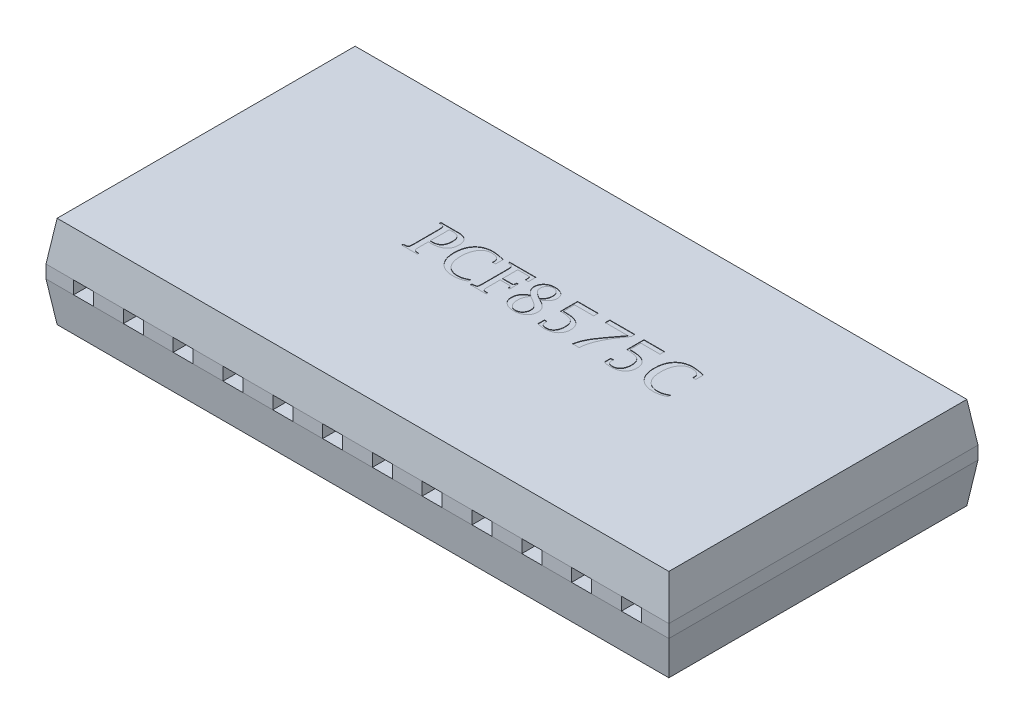
from build123d import *

# Parameters (mm, degrees)
SKETCH1_W           = 15.6
SKETCH1_H           = 7.6
BOSS_EXTRUDE1_DEPTH = 1.01
BOSS_EXTRUDE1_DRAFT = -8
SKETCH2_W           = 15.883892486
SKETCH2_H           = 7.883892486
BOSS_EXTRUDE2_DEPTH = 0.33
SKETCH3_W           = 15.883892486
SKETCH3_H           = 7.883892486
BOSS_EXTRUDE3_DEPTH = 1.01
BOSS_EXTRUDE3_TAPER = 8
SKETCH4_W           = 0.51
SKETCH4_H           = 0.33
CUT_EXTRUDE1_DEPTH  = 9.01
CUT_EXTRUDE2_DEPTH  = 0.01


with BuildPart() as part:
    # Sketch1 → Boss-Extrude1 (with draft: the straight prism first)
    with BuildSketch(Plane(origin=(0, 0, 0), x_dir=(1, 0, 0), z_dir=(0, 1, 0))):
        Rectangle(SKETCH1_W, SKETCH1_H)
    extrude(amount=BOSS_EXTRUDE1_DEPTH)
    # Boss-Extrude1: the draft: its side faces are tilted about the plane it starts from
    boss_extrude1_sides = [part.faces().sort_by_distance(p)[0] for p in [
        (-7.8, 0.505, 0),
        (0, 0.505, 3.8),
        (7.8, 0.505, 0),
        (0, 0.505, -3.8),
    ]]
    draft(boss_extrude1_sides, Plane(origin=(0, 0, 0), x_dir=(1, 0, 0), z_dir=(0, 1, 0)), BOSS_EXTRUDE1_DRAFT)

    # Sketch2 → Boss-Extrude2 (add)
    with BuildSketch(Plane(origin=(0, 1.01, 0), x_dir=(1, 0, 0), z_dir=(0, 1, 0))):
        Rectangle(SKETCH2_W, SKETCH2_H)
    extrude(amount=BOSS_EXTRUDE2_DEPTH)

    # Sketch3 → Boss-Extrude3 (add)
    with BuildSketch(Plane(origin=(0, 1.34, 0), x_dir=(1, 0, 0), z_dir=(0, 1, 0))):
        Rectangle(SKETCH3_W, SKETCH3_H)
    extrude(amount=BOSS_EXTRUDE3_DEPTH, taper=BOSS_EXTRUDE3_TAPER)

    # Sketch4 → Cut-Extrude1 (cut)
    with BuildSketch(Plane.XY.offset(3.941946243)):
        with Locations((6.986946243, 1.175)):
            Rectangle(SKETCH4_W, SKETCH4_H)
        with Locations((5.716946243, 1.175)):
            Rectangle(SKETCH4_W, SKETCH4_H)
        with Locations((4.446946243, 1.175)):
            Rectangle(SKETCH4_W, SKETCH4_H)
        with Locations((3.176946243, 1.175)):
            Rectangle(SKETCH4_W, SKETCH4_H)
        with Locations((1.906946243, 1.175)):
            Rectangle(SKETCH4_W, SKETCH4_H)
        with Locations((0.636946243, 1.175)):
            Rectangle(SKETCH4_W, SKETCH4_H)
        with Locations((-0.633053757, 1.175)):
            Rectangle(SKETCH4_W, SKETCH4_H)
        with Locations((-1.903053757, 1.175)):
            Rectangle(SKETCH4_W, SKETCH4_H)
        with Locations((-3.173053757, 1.175)):
            Rectangle(SKETCH4_W, SKETCH4_H)
        with Locations((-4.443053757, 1.175)):
            Rectangle(SKETCH4_W, SKETCH4_H)
        with Locations((-5.713053757, 1.175)):
            Rectangle(SKETCH4_W, SKETCH4_H)
        with Locations((-6.983053757, 1.175)):
            Rectangle(SKETCH4_W, SKETCH4_H)
    extrude(amount=-CUT_EXTRUDE1_DEPTH, mode=Mode.SUBTRACT)

    # Sketch5 → Cut-Extrude2 (cut)
    # profile 1 of 8: a face of its own
    with BuildSketch(Plane(origin=(0, 2.35, 0), x_dir=(1, 0, 0), z_dir=(0, 1, 0))):
        with BuildLine():
            Line((-2.54490648, 0.41025641), (-2.54490648, 0.179487179))
            add(Edge.make_bspline(
                [(-2.54490648, 0.179487179), (-2.544900951, 0.171940387), (-2.544890477, 0.157643208), (-2.543938519, 0.137347488), (-2.543097805, 0.119364644), (-2.541592105, 0.103696877), (-2.539264612, 0.090438534), (-2.537108211, 0.079356538), (-2.534131834, 0.070680065), (-2.530665831, 0.063801238), (-2.525525477, 0.058673223), (-2.519017387, 0.054256998), (-2.510625249, 0.050561064), (-2.500587919, 0.047147558), (-2.488703632, 0.044410722), (-2.475035718, 0.04230199), (-2.459599352, 0.040491789), (-2.448689818, 0.039686826), (-2.442943339, 0.039262821)],
                knots=[0, 0, 0, 0, 1.721747236, 3.261800149, 4.63516406, 5.829814576, 6.849268245, 7.706967564, 8.400837902, 8.939515546, 9.445987131, 10.037650411, 10.726147035, 11.530780707, 12.454671759, 13.504194985, 14.685361651, 16, 16, 16, 16], degree=3))
            Line((-2.442943339, 0.039262821), (-2.416701352, 0.038461538))
            Line((-2.416701352, 0.038461538), (-2.416701352, 0))
            Line((-2.416701352, 0), (-2.814137249, 0))
            Line((-2.814137249, 0), (-2.814137249, 0.038461538))
            Line((-2.814137249, 0.038461538), (-2.800916095, 0.039262821))
            add(Edge.make_bspline(
                [(-2.800916095, 0.039262821), (-2.794301054, 0.039751344), (-2.781721179, 0.040680373), (-2.763953948, 0.042699998), (-2.748260771, 0.044928347), (-2.734816612, 0.048085032), (-2.723303826, 0.051027352), (-2.714086347, 0.054886764), (-2.706760666, 0.058802926), (-2.701201646, 0.063709757), (-2.697474794, 0.070444981), (-2.69436981, 0.07896434), (-2.691607711, 0.089834681), (-2.689489315, 0.103107581), (-2.687985173, 0.118767426), (-2.686810164, 0.136871704), (-2.685976606, 0.157377572), (-2.685947439, 0.171874085), (-2.685932121, 0.179487179)],
                knots=[0, 0, 0, 0, 1.434223856, 2.727474356, 3.867048795, 4.858481374, 5.713375648, 6.432048766, 7.014145389, 7.504681859, 8.009876932, 8.658876013, 9.464418017, 10.430606696, 11.562838439, 12.865326848, 14.353772105, 16, 16, 16, 16], degree=3))
            Line((-2.685932121, 0.179487179), (-2.685932121, 0.820512821))
            add(Edge.make_bspline(
                [(-2.685932121, 0.820512821), (-2.685946655, 0.82819269), (-2.685974216, 0.842755975), (-2.686809812, 0.863328735), (-2.687986105, 0.881432534), (-2.689486541, 0.897093827), (-2.69161582, 0.910362461), (-2.694331766, 0.921184364), (-2.697469905, 0.929562005), (-2.701205042, 0.93612031), (-2.706838368, 0.940766112), (-2.714031218, 0.944768734), (-2.72336647, 0.948280657), (-2.734776105, 0.951410397), (-2.748316635, 0.954122253), (-2.763923129, 0.95681024), (-2.7817272, 0.95868536), (-2.794303129, 0.959636217), (-2.800916095, 0.960136218)],
                knots=[0, 0, 0, 0, 1.663492872, 3.154470594, 4.459175079, 5.59333322, 6.561165788, 7.368078355, 8.00468548, 8.498392893, 8.980088247, 9.563175259, 10.277674215, 11.13402302, 12.124082947, 13.267885073, 14.563335932, 16, 16, 16, 16], degree=3))
            Line((-2.800916095, 0.960136218), (-2.814137249, 0.961538462))
            Line((-2.814137249, 0.961538462), (-2.814137249, 1))
            Line((-2.814137249, 1), (-2.518263852, 1))
            Line((-2.518263852, 1), (-2.420106801, 1))
            Line((-2.420106801, 1), (-2.373832762, 1.001402244))
            add(Edge.make_bspline(
                [(-2.373832762, 1.001402244), (-2.362071996, 1.001244201), (-2.339304746, 1.000938252), (-2.306312443, 0.99761621), (-2.275619969, 0.992543105), (-2.247144695, 0.985280052), (-2.220833357, 0.976198514), (-2.196767546, 0.964804898), (-2.175284842, 0.950917758), (-2.155473323, 0.93568841), (-2.138767616, 0.917467507), (-2.123632556, 0.897831521), (-2.111283155, 0.875750049), (-2.101043981, 0.851772178), (-2.092960751, 0.825743478), (-2.087524066, 0.797592825), (-2.084034755, 0.767381576), (-2.083595032, 0.74653803), (-2.083368019, 0.735777244)],
                knots=[0, 0, 0, 0, 1.250430274, 2.420663812, 3.522824594, 4.556308805, 5.542341582, 6.47940938, 7.379777482, 8.259318291, 9.128446895, 10.000558968, 10.8911267, 11.810590311, 12.769761113, 13.783710632, 14.85580808, 16, 16, 16, 16], degree=3))
            add(Edge.make_bspline(
                [(-2.083368019, 0.735777244), (-2.083639536, 0.722672133), (-2.084168076, 0.697161556), (-2.089301106, 0.660193782), (-2.097447411, 0.625667744), (-2.108860932, 0.593648389), (-2.123497107, 0.56407649), (-2.141768934, 0.537255516), (-2.163103373, 0.512765398), (-2.187975585, 0.491058014), (-2.216095568, 0.471982805), (-2.247350022, 0.455255198), (-2.281972856, 0.441313761), (-2.319885614, 0.429965526), (-2.360999989, 0.420986641), (-2.405455308, 0.414685974), (-2.453158159, 0.41084796), (-2.486071476, 0.410457636), (-2.503039493, 0.41025641)],
                knots=[0, 0, 0, 0, 1.036758872, 2.01816814, 2.947549626, 3.840261096, 4.70297757, 5.55172306, 6.401915408, 7.267024549, 8.156852657, 9.086113912, 10.067565873, 11.105845897, 12.215105469, 13.395312345, 14.657188413, 16, 16, 16, 16], degree=3))
            Line((-2.503039493, 0.41025641), (-2.54490648, 0.41025641))
        make_face()
        with BuildLine():
            Line((-2.54490648, 0.461538462), (-2.49803148, 0.461538462))
            add(Edge.make_bspline(
                [(-2.49803148, 0.461538462), (-2.48800698, 0.461706665), (-2.468504241, 0.462033906), (-2.440208019, 0.465253864), (-2.413873378, 0.470661334), (-2.389443157, 0.47797989), (-2.367093511, 0.487657577), (-2.346610678, 0.499344161), (-2.328058239, 0.513221371), (-2.311480645, 0.529377591), (-2.297057037, 0.547805026), (-2.284347395, 0.568113086), (-2.273680581, 0.590654587), (-2.26496772, 0.615230481), (-2.258097921, 0.641972941), (-2.253414751, 0.670801629), (-2.250618861, 0.701734155), (-2.250233218, 0.723017467), (-2.250034685, 0.733974359)],
                knots=[0, 0, 0, 0, 1.138636481, 2.215225831, 3.229973037, 4.189922479, 5.107410983, 5.991024994, 6.863495058, 7.732627188, 8.61297821, 9.516081906, 10.449276379, 11.440349826, 12.474480807, 13.582034521, 14.755203701, 16, 16, 16, 16], degree=3))
            add(Edge.make_bspline(
                [(-2.250034685, 0.733974359), (-2.250189841, 0.743261054), (-2.250489454, 0.761194035), (-2.252736822, 0.787080718), (-2.256167271, 0.810959126), (-2.261436006, 0.832717759), (-2.267945801, 0.852510861), (-2.276139391, 0.870201952), (-2.285828242, 0.885811216), (-2.296966164, 0.89953604), (-2.310002583, 0.911255272), (-2.324895052, 0.921404665), (-2.341703176, 0.929993981), (-2.360658168, 0.936776768), (-2.381464713, 0.942066604), (-2.404208828, 0.946165789), (-2.428949498, 0.948223769), (-2.446078577, 0.948549176), (-2.45496257, 0.948717949)],
                knots=[0, 0, 0, 0, 1.289907877, 2.49086379, 3.607272963, 4.637710631, 5.596921144, 6.497464913, 7.339137542, 8.143218434, 8.944404818, 9.765166916, 10.640515651, 11.55903423, 12.555726557, 13.620214006, 14.76572449, 16, 16, 16, 16], degree=3))
            Line((-2.45496257, 0.948717949), (-2.54490648, 0.948717949))
            Line((-2.54490648, 0.948717949), (-2.54490648, 0.461538462))
        make_face(mode=Mode.SUBTRACT)
    # profile 2 of 8: a face of its own
    with BuildSketch(Plane(origin=(0, 2.35, 0), x_dir=(1, 0, 0), z_dir=(0, 1, 0))):
        with BuildLine():
            add(Edge.make_bspline(
                [(-1.173111608, 0.051282051), (-1.184509921, 0.045098096), (-1.207373049, 0.032694106), (-1.243402108, 0.017173883), (-1.280680954, 0.003943184), (-1.319354745, -0.00693572), (-1.359450844, -0.015311751), (-1.400933371, -0.021259529), (-1.443809865, -0.024983853), (-1.472850162, -0.025419523), (-1.487614813, -0.025641026)],
                knots=[0, 0, 0, 0, 0.950097763, 1.905738653, 2.871688724, 3.847851376, 4.848060568, 5.871763302, 6.917963107, 8, 8, 8, 8], degree=3))
            add(Edge.make_bspline(
                [(-1.487614813, -0.025641026), (-1.506198699, -0.025238229), (-1.542554025, -0.024450246), (-1.595526174, -0.017708574), (-1.645576891, -0.006852396), (-1.69244231, 0.00892245), (-1.736405735, 0.028697223), (-1.777263469, 0.053189732), (-1.814978366, 0.08214106), (-1.849578619, 0.11527164), (-1.880291557, 0.152365401), (-1.907380411, 0.192710832), (-1.930315496, 0.236323482), (-1.948680725, 0.283355308), (-1.963104199, 0.333456528), (-1.973470906, 0.386801551), (-1.979759418, 0.443358059), (-1.980450409, 0.482154941), (-1.980803916, 0.502003205)],
                knots=[0, 0, 0, 0, 1.0907127, 2.133741934, 3.129613494, 4.092881734, 5.031519219, 5.954636873, 6.883025615, 7.817429068, 8.761096259, 9.704885592, 10.665853524, 11.647925027, 12.664084858, 13.722792364, 14.834993506, 16, 16, 16, 16], degree=3))
            add(Edge.make_bspline(
                [(-1.980803916, 0.502003205), (-1.980422377, 0.52211633), (-1.979679177, 0.561294784), (-1.973826818, 0.618364305), (-1.964132826, 0.672061986), (-1.950319182, 0.722279089), (-1.932725721, 0.769118891), (-1.910968131, 0.812382871), (-1.885515625, 0.852353742), (-1.855918263, 0.888508967), (-1.822819698, 0.920865809), (-1.786397791, 0.949048665), (-1.746823562, 0.972897503), (-1.704007217, 0.992146637), (-1.658064671, 1.007178089), (-1.609017783, 1.017927694), (-1.556832148, 1.024409578), (-1.521020545, 1.025223334), (-1.502638852, 1.025641026)],
                knots=[0, 0, 0, 0, 1.198437993, 2.334443252, 3.414667221, 4.446694533, 5.434080735, 6.391511889, 7.327567475, 8.252356355, 9.169726966, 10.0802973, 10.990685018, 11.916765772, 12.871878647, 13.866328085, 14.904810219, 16, 16, 16, 16], degree=3))
            add(Edge.make_bspline(
                [(-1.502638852, 1.025641026), (-1.492618707, 1.025472835), (-1.471751015, 1.025122564), (-1.439403538, 1.022578278), (-1.404797453, 1.018527853), (-1.367926574, 1.012859747), (-1.328776313, 1.005665418), (-1.287385014, 0.996744997), (-1.243756636, 0.986379002), (-1.214025227, 0.9784381), (-1.198752634, 0.974358974)],
                knots=[0, 0, 0, 0, 0.778211485, 1.620683054, 2.518725369, 3.483977919, 4.517483666, 5.609946115, 6.772264103, 8, 8, 8, 8], degree=3))
            Line((-1.198752634, 0.974358974), (-1.198752634, 0.782051282))
            Line((-1.198752634, 0.782051282), (-1.275675711, 0.782051282))
            Line((-1.275675711, 0.782051282), (-1.275675711, 0.795272436))
            add(Edge.make_bspline(
                [(-1.275675711, 0.795272436), (-1.275675711, 0.801883013), (-1.275675711, 0.81497062), (-1.275675711, 0.828058226), (-1.275675711, 0.834535256)],
                knots=[0, 0, 0, 0, 1.010204082, 2, 2, 2, 2], degree=3))
            add(Edge.make_bspline(
                [(-1.275675711, 0.834535256), (-1.275892618, 0.839819871), (-1.276315403, 0.8501204), (-1.278920584, 0.865242625), (-1.283562194, 0.879439985), (-1.289950909, 0.89289286), (-1.29865828, 0.905104176), (-1.308590051, 0.916925638), (-1.320834953, 0.927477816), (-1.33463801, 0.937293277), (-1.350031871, 0.946025582), (-1.366778237, 0.953688724), (-1.384884572, 0.960096883), (-1.404409059, 0.965201666), (-1.425180014, 0.969514184), (-1.447366474, 0.972133019), (-1.470754201, 0.974054497), (-1.486809151, 0.974255893), (-1.495026672, 0.974358974)],
                knots=[0, 0, 0, 0, 0.872940392, 1.70149544, 2.524527953, 3.333401312, 4.150129811, 4.994603991, 5.877449129, 6.810717511, 7.788717292, 8.795394151, 9.848766788, 10.956224994, 12.126265042, 13.349109787, 14.643175601, 16, 16, 16, 16], degree=3))
            add(Edge.make_bspline(
                [(-1.495026672, 0.974358974), (-1.506871308, 0.973987283), (-1.530117969, 0.973257789), (-1.564080933, 0.967115426), (-1.59615142, 0.956891596), (-1.626337121, 0.942424473), (-1.654747409, 0.924137373), (-1.68114723, 0.90159105), (-1.7057418, 0.875108789), (-1.728157597, 0.844722147), (-1.748360259, 0.81102497), (-1.765999514, 0.774396177), (-1.780962642, 0.735119269), (-1.793270939, 0.693132992), (-1.802503901, 0.648424027), (-1.809339502, 0.601002708), (-1.813318365, 0.550882863), (-1.813859969, 0.516566879), (-1.814137249, 0.498998397)],
                knots=[0, 0, 0, 0, 0.888373946, 1.743551007, 2.580294788, 3.407379563, 4.248314273, 5.108731313, 6.00576896, 6.954874221, 7.937159125, 8.950188932, 10.001809612, 11.088010484, 12.230028994, 13.42485153, 14.681621673, 16, 16, 16, 16], degree=3))
            add(Edge.make_bspline(
                [(-1.814137249, 0.498998397), (-1.813850772, 0.481358154), (-1.813294045, 0.447076995), (-1.808375291, 0.397140125), (-1.800515794, 0.350164848), (-1.789242339, 0.306171471), (-1.775187468, 0.26499547), (-1.757338361, 0.227011205), (-1.736850735, 0.191663436), (-1.712674566, 0.159804391), (-1.685779818, 0.131217174), (-1.656284675, 0.106226421), (-1.624150075, 0.085242609), (-1.589557074, 0.068144529), (-1.55252143, 0.054560843), (-1.512807263, 0.045410166), (-1.470776582, 0.03931042), (-1.441897636, 0.038748908), (-1.427118019, 0.038461538)],
                knots=[0, 0, 0, 0, 1.242005494, 2.413650741, 3.529974997, 4.592937592, 5.608668543, 6.589038791, 7.54391707, 8.480640935, 9.398755183, 10.303097998, 11.196518338, 12.094493543, 13.015313349, 13.967687329, 14.959906499, 16, 16, 16, 16], degree=3))
            add(Edge.make_bspline(
                [(-1.427118019, 0.038461538), (-1.417091489, 0.038696789), (-1.396841925, 0.039171901), (-1.366243226, 0.042972032), (-1.335125636, 0.049003546), (-1.303525077, 0.057410627), (-1.271510939, 0.068357308), (-1.239034199, 0.081656054), (-1.205947439, 0.09721001), (-1.184197131, 0.109248788), (-1.173111608, 0.115384615)],
                knots=[0, 0, 0, 0, 0.896500142, 1.810570349, 2.753391962, 3.729718686, 4.732516545, 5.777170997, 6.867086282, 8, 8, 8, 8], degree=3))
            Line((-1.173111608, 0.115384615), (-1.173111608, 0.051282051))
        make_face()
    # profile 3 of 8: a face of its own
    with BuildSketch(Plane(origin=(0, 2.35, 0), x_dir=(1, 0, 0), z_dir=(0, 1, 0))):
        with BuildLine():
            Line((-0.788496224, 0.487179487), (-0.788496224, 0.179487179))
            add(Edge.make_bspline(
                [(-0.788496224, 0.179487179), (-0.788462087, 0.172742471), (-0.788396842, 0.159851105), (-0.787791743, 0.141416441), (-0.786849979, 0.12484288), (-0.785407913, 0.110083983), (-0.78380359, 0.09712979), (-0.781247442, 0.086015797), (-0.778834259, 0.076629452), (-0.774948701, 0.066688305), (-0.767596261, 0.056477983), (-0.754495636, 0.04839419), (-0.7381824, 0.043299379), (-0.726107942, 0.042889606), (-0.719585967, 0.042668269)],
                knots=[0, 0, 0, 0, 1.370981959, 2.620399742, 3.749035402, 4.744439625, 5.635128633, 6.399228633, 7.061132633, 7.603050211, 8.564082396, 9.554197555, 10.678908651, 12, 12, 12, 12], degree=3))
            add(Edge.make_bspline(
                [(-0.719585967, 0.042668269), (-0.718250371, 0.042603932), (-0.713840219, 0.042391488), (-0.704553495, 0.04177578), (-0.690016176, 0.040457376), (-0.678522678, 0.039699105), (-0.671909685, 0.039262821)],
                knots=[0, 0, 0, 0, 0.33568548, 1.108436944, 2.336286713, 4, 4, 4, 4], degree=3))
            Line((-0.671909685, 0.039262821), (-0.660291095, 0.038461538))
            Line((-0.660291095, 0.038461538), (-0.660291095, 0))
            Line((-0.660291095, 0), (-1.057726993, 0))
            Line((-1.057726993, 0), (-1.057726993, 0.038461538))
            Line((-1.057726993, 0.038461538), (-1.044505839, 0.039262821))
            add(Edge.make_bspline(
                [(-1.044505839, 0.039262821), (-1.037890797, 0.039751344), (-1.025310922, 0.040680373), (-1.007543692, 0.042699998), (-0.991850515, 0.044928347), (-0.978406355, 0.048085032), (-0.966893569, 0.051027352), (-0.957676091, 0.054886764), (-0.950350409, 0.058802926), (-0.944791389, 0.063709757), (-0.941064538, 0.070444981), (-0.937959553, 0.07896434), (-0.935197454, 0.089834681), (-0.933079059, 0.103107581), (-0.931574917, 0.118767426), (-0.930399907, 0.136871704), (-0.929566349, 0.157377572), (-0.929537182, 0.171874085), (-0.929521865, 0.179487179)],
                knots=[0, 0, 0, 0, 1.434223856, 2.727474356, 3.867048795, 4.858481374, 5.713375648, 6.432048766, 7.014145389, 7.504681859, 8.009876932, 8.658876013, 9.464418017, 10.430606696, 11.562838439, 12.865326848, 14.353772105, 16, 16, 16, 16], degree=3))
            Line((-0.929521865, 0.179487179), (-0.929521865, 0.820512821))
            add(Edge.make_bspline(
                [(-0.929521865, 0.820512821), (-0.929536399, 0.82819269), (-0.929563959, 0.842755975), (-0.930399555, 0.863328735), (-0.931575848, 0.881432534), (-0.933076284, 0.897093827), (-0.935205564, 0.910362461), (-0.93792151, 0.921184364), (-0.941059649, 0.929562005), (-0.944794785, 0.93612031), (-0.950428112, 0.940766112), (-0.957620961, 0.944768734), (-0.966956214, 0.948280657), (-0.978365848, 0.951410397), (-0.991906379, 0.954122253), (-1.007512873, 0.95681024), (-1.025316944, 0.95868536), (-1.037892873, 0.959636217), (-1.044505839, 0.960136218)],
                knots=[0, 0, 0, 0, 1.663492872, 3.154470594, 4.459175079, 5.59333322, 6.561165788, 7.368078355, 8.00468548, 8.498392893, 8.980088247, 9.563175259, 10.277674215, 11.13402302, 12.124082947, 13.267885073, 14.563335932, 16, 16, 16, 16], degree=3))
            Line((-1.044505839, 0.960136218), (-1.057726993, 0.961538462))
            Line((-1.057726993, 0.961538462), (-1.057726993, 1))
            Line((-1.057726993, 1), (-0.391060326, 1))
            Line((-0.391060326, 1), (-0.391060326, 0.807692308))
            Line((-0.391060326, 0.807692308), (-0.467983403, 0.807692308))
            Line((-0.467983403, 0.807692308), (-0.468784685, 0.821314103))
            add(Edge.make_bspline(
                [(-0.468784685, 0.821314103), (-0.469229161, 0.82906088), (-0.470064957, 0.843627993), (-0.471580918, 0.864076232), (-0.473567972, 0.881668569), (-0.474862641, 0.896504124), (-0.476993032, 0.908343204), (-0.47880854, 0.917494876), (-0.480918405, 0.923682374), (-0.483287942, 0.928337037), (-0.488322412, 0.930006284), (-0.494861411, 0.931944582), (-0.504663935, 0.932726501), (-0.517222918, 0.934157922), (-0.532826582, 0.934666921), (-0.551303237, 0.935728135), (-0.572753357, 0.935643977), (-0.588042997, 0.935809339), (-0.596188531, 0.935897436)],
                knots=[0, 0, 0, 0, 1.680288217, 3.15962939, 4.438653293, 5.514849284, 6.380093388, 7.046617638, 7.522226697, 7.814997939, 8.118979767, 8.613551646, 9.312981904, 10.228016992, 11.35729639, 12.688775674, 14.235949932, 16, 16, 16, 16], degree=3))
            Line((-0.596188531, 0.935897436), (-0.788496224, 0.935897436))
            Line((-0.788496224, 0.935897436), (-0.788496224, 0.551282051))
            Line((-0.788496224, 0.551282051), (-0.609009044, 0.551282051))
            add(Edge.make_bspline(
                [(-0.609009044, 0.551282051), (-0.603599751, 0.551238817), (-0.593380343, 0.551157137), (-0.578894547, 0.551697922), (-0.566067378, 0.551999488), (-0.554847574, 0.552615423), (-0.545283159, 0.553330805), (-0.537418515, 0.55441943), (-0.531145362, 0.555266514), (-0.526188482, 0.556624147), (-0.522086613, 0.559038143), (-0.518944267, 0.563087088), (-0.516199988, 0.568423345), (-0.513555043, 0.575113032), (-0.51143836, 0.58339192), (-0.50968081, 0.593169955), (-0.508332418, 0.60448188), (-0.507623642, 0.612511268), (-0.507246224, 0.616786859)],
                knots=[0, 0, 0, 0, 1.751385194, 3.30877253, 4.693258577, 5.905829026, 6.947284358, 7.797445791, 8.476391601, 8.996220685, 9.452338107, 9.989418424, 10.627909597, 11.394806486, 12.312661423, 13.389864397, 14.610121581, 16, 16, 16, 16], degree=3))
            Line((-0.507246224, 0.616786859), (-0.506444942, 0.628205128))
            Line((-0.506444942, 0.628205128), (-0.467983403, 0.628205128))
            Line((-0.467983403, 0.628205128), (-0.467983403, 0.41025641))
            Line((-0.467983403, 0.41025641), (-0.506444942, 0.41025641))
            Line((-0.506444942, 0.41025641), (-0.507246224, 0.422075321))
            add(Edge.make_bspline(
                [(-0.507246224, 0.422075321), (-0.507943993, 0.429179234), (-0.509193239, 0.44189766), (-0.513045863, 0.458539108), (-0.518068405, 0.470796333), (-0.524562919, 0.477744815), (-0.531066661, 0.480663956), (-0.537344254, 0.482412522), (-0.545293649, 0.483666748), (-0.554816064, 0.485166422), (-0.566059411, 0.486091295), (-0.578889725, 0.486627349), (-0.593381693, 0.487040704), (-0.603600092, 0.487131451), (-0.609009044, 0.487179487)],
                knots=[0, 0, 0, 0, 1.773766812, 3.175646797, 4.238246652, 5.036871456, 5.460324792, 5.996470383, 6.654580711, 7.460255629, 8.394071235, 9.458227633, 10.654551766, 12, 12, 12, 12], degree=3))
            Line((-0.609009044, 0.487179487), (-0.788496224, 0.487179487))
        make_face()
    # profile 4 of 8: a face of its own
    with BuildSketch(Plane(origin=(0, 2.35, 0), x_dir=(1, 0, 0), z_dir=(0, 1, 0))):
        with BuildLine():
            add(Edge.make_bspline(
                [(-0.059329557, 0.538461538), (-0.071372182, 0.547208681), (-0.094555779, 0.564048053), (-0.125614325, 0.591673151), (-0.151967745, 0.619868166), (-0.173790732, 0.648664925), (-0.19058471, 0.678245675), (-0.202577203, 0.708499813), (-0.210192077, 0.739408625), (-0.211113493, 0.760374415), (-0.211573147, 0.770833333)],
                knots=[0, 0, 0, 0, 1.235470982, 2.378440043, 3.445684424, 4.436056507, 5.372159975, 6.260810668, 7.132394353, 8, 8, 8, 8], degree=3))
            add(Edge.make_bspline(
                [(-0.211573147, 0.770833333), (-0.211364395, 0.780061378), (-0.210954099, 0.798198801), (-0.207068047, 0.824728963), (-0.200659675, 0.849902172), (-0.19174389, 0.873716032), (-0.180586181, 0.89637718), (-0.166381523, 0.917416261), (-0.149876539, 0.937165497), (-0.130971775, 0.9553791), (-0.110158352, 0.971903379), (-0.087456543, 0.98619732), (-0.063349278, 0.998475243), (-0.037610408, 1.008573984), (-0.010231374, 1.016010426), (0.018525334, 1.021764848), (0.048842691, 1.024864264), (0.06953707, 1.025378637), (0.08009352, 1.025641026)],
                knots=[0, 0, 0, 0, 1.017603329, 2.000066475, 2.950634958, 3.878406239, 4.800897718, 5.730568226, 6.671928419, 7.635764454, 8.621784215, 9.598707632, 10.590407862, 11.602771015, 12.643054995, 13.716537606, 14.835178607, 16, 16, 16, 16], degree=3))
            add(Edge.make_bspline(
                [(0.08009352, 1.025641026), (0.090183354, 1.025445024), (0.109868885, 1.025062619), (0.138582443, 1.022196766), (0.165798551, 1.017676993), (0.191400197, 1.011094677), (0.215447815, 1.002611707), (0.238034812, 0.992403327), (0.259068302, 0.980221079), (0.278343264, 0.966120852), (0.295753522, 0.950635963), (0.310877747, 0.933653128), (0.323837203, 0.915585444), (0.334328517, 0.896109282), (0.34258743, 0.875420742), (0.348382146, 0.853425676), (0.351832953, 0.830170812), (0.352293465, 0.814248071), (0.352529417, 0.806089744)],
                knots=[0, 0, 0, 0, 1.230491035, 2.400720398, 3.516068681, 4.592651107, 5.620438456, 6.622739508, 7.611749461, 8.579401848, 9.531052595, 10.448202443, 11.347642563, 12.23684711, 13.139746769, 14.058378078, 15.005172094, 16, 16, 16, 16], degree=3))
            add(Edge.make_bspline(
                [(0.352529417, 0.806089744), (0.352364012, 0.799739845), (0.352037428, 0.787202253), (0.349770933, 0.768568655), (0.346035267, 0.750381294), (0.34047476, 0.732616596), (0.33373169, 0.715241498), (0.325447466, 0.698166474), (0.315397484, 0.681746471), (0.304091784, 0.665447185), (0.291102667, 0.649760128), (0.276580807, 0.634506762), (0.260635835, 0.619541739), (0.243112961, 0.605112765), (0.224139653, 0.590883149), (0.203436201, 0.57745613), (0.181531992, 0.56390669), (0.166079314, 0.555671581), (0.15821852, 0.551482372)],
                knots=[0, 0, 0, 0, 0.902053673, 1.781064641, 2.662988873, 3.536247224, 4.42239645, 5.309154853, 6.228405224, 7.154823824, 8.125366216, 9.118549546, 10.145459491, 11.230164823, 12.342035522, 13.512927594, 14.734823609, 16, 16, 16, 16], degree=3))
            add(Edge.make_bspline(
                [(0.15821852, 0.551482372), (0.168147522, 0.547243701), (0.187608667, 0.53893578), (0.215410274, 0.525010754), (0.241439274, 0.510734759), (0.265542835, 0.495579236), (0.287587647, 0.47968098), (0.307858256, 0.463156708), (0.326126298, 0.445879236), (0.342610231, 0.427975745), (0.356881187, 0.409068194), (0.369619766, 0.389806607), (0.379998903, 0.369574838), (0.388757622, 0.348781479), (0.395509203, 0.327248885), (0.400379782, 0.305000656), (0.403199882, 0.282057492), (0.40360572, 0.266500683), (0.403811469, 0.258613782)],
                knots=[0, 0, 0, 0, 1.270931196, 2.491063488, 3.659484921, 4.765445501, 5.841229715, 6.858018447, 7.842464959, 8.799754576, 9.719700648, 10.629103352, 11.515301602, 12.392877746, 13.283112732, 14.168333839, 15.071392509, 16, 16, 16, 16], degree=3))
            add(Edge.make_bspline(
                [(0.403811469, 0.258613782), (0.403596402, 0.248376427), (0.403175181, 0.228325973), (0.39825551, 0.199018804), (0.391022749, 0.171075707), (0.380464994, 0.144600031), (0.366967728, 0.119580984), (0.35037915, 0.096089633), (0.331021992, 0.073820176), (0.308651858, 0.053433578), (0.284095138, 0.034882881), (0.257753632, 0.018481942), (0.229544646, 0.004938281), (0.199765083, -0.006418609), (0.168194725, -0.014926358), (0.134975178, -0.021110888), (0.100086154, -0.025037523), (0.076231265, -0.025437222), (0.064067879, -0.025641026)],
                knots=[0, 0, 0, 0, 0.989470554, 1.937935584, 2.867196409, 3.777741942, 4.688287476, 5.611306817, 6.554520819, 7.537537799, 8.533734375, 9.52875718, 10.5342531, 11.55654412, 12.608176456, 13.692787712, 14.823573918, 16, 16, 16, 16], degree=3))
            add(Edge.make_bspline(
                [(0.064067879, -0.025641026), (0.052174709, -0.025401061), (0.028939167, -0.024932244), (-0.005029105, -0.021544681), (-0.037222299, -0.015683802), (-0.067768155, -0.00778341), (-0.096601528, 0.002698735), (-0.123687803, 0.015528107), (-0.149050203, 0.030605987), (-0.172514673, 0.047796773), (-0.193637559, 0.066944441), (-0.212335358, 0.087601522), (-0.227739147, 0.11009923), (-0.240776161, 0.133755894), (-0.250508378, 0.159083124), (-0.257840858, 0.185619512), (-0.262083111, 0.213739155), (-0.262593936, 0.232958654), (-0.262855198, 0.242788462)],
                knots=[0, 0, 0, 0, 1.202161924, 2.348649329, 3.446227137, 4.507140741, 5.534210673, 6.542657962, 7.532408414, 8.512537285, 9.477841653, 10.410034752, 11.321894014, 12.227989094, 13.134235011, 14.057761382, 15.006642549, 16, 16, 16, 16], degree=3))
            add(Edge.make_bspline(
                [(-0.262855198, 0.242788462), (-0.262709665, 0.251074865), (-0.262423832, 0.267349716), (-0.259913592, 0.291375287), (-0.256008706, 0.314560789), (-0.250280211, 0.336876391), (-0.243389474, 0.358469225), (-0.234476279, 0.379021129), (-0.224225278, 0.398915621), (-0.212194556, 0.417807457), (-0.198711929, 0.436046711), (-0.183467804, 0.453172272), (-0.166659254, 0.469564397), (-0.14831871, 0.485093097), (-0.128351704, 0.49978059), (-0.106856676, 0.513589538), (-0.083799645, 0.526671543), (-0.067590483, 0.534481321), (-0.059329557, 0.538461538)],
                knots=[0, 0, 0, 0, 1.041162887, 2.044888676, 3.032736595, 3.993440739, 4.938214892, 5.878168641, 6.80529738, 7.748243429, 8.68984412, 9.653000959, 10.626268621, 11.638483689, 12.670747295, 13.739218098, 14.847802764, 16, 16, 16, 16], degree=3))
        make_face()
        with BuildLine():
            add(Edge.make_bspline(
                [(0.122761789, 0.574519231), (0.131891588, 0.581861531), (0.149789682, 0.596255407), (0.173109001, 0.620958699), (0.192979867, 0.647316444), (0.209003493, 0.675597659), (0.221898503, 0.705414181), (0.230536837, 0.737195623), (0.236187497, 0.770631643), (0.236821363, 0.793579161), (0.237144802, 0.805288462)],
                knots=[0, 0, 0, 0, 1.049780005, 2.05799296, 3.037789665, 4.003482535, 4.966813998, 5.943310481, 6.950544631, 8, 8, 8, 8], degree=3))
            add(Edge.make_bspline(
                [(0.237144802, 0.805288462), (0.236955424, 0.811968149), (0.236587169, 0.824957128), (0.234746569, 0.844046378), (0.230740802, 0.861995639), (0.225971068, 0.879153615), (0.21908737, 0.895031662), (0.211456406, 0.910290663), (0.201670483, 0.924194471), (0.190895593, 0.937264623), (0.178999315, 0.949099872), (0.165778926, 0.959176515), (0.151716909, 0.96775634), (0.136807221, 0.975187269), (0.120718035, 0.980472539), (0.103798697, 0.984225112), (0.085979021, 0.986773436), (0.073759272, 0.987041561), (0.067473328, 0.987179487)],
                knots=[0, 0, 0, 0, 1.14476972, 2.226060639, 3.278220725, 4.291678839, 5.270995093, 6.237941673, 7.208804398, 8.175412636, 9.137951497, 10.075982343, 11.015685508, 11.956988524, 12.922784259, 13.907895137, 14.923803245, 16, 16, 16, 16], degree=3))
            add(Edge.make_bspline(
                [(0.067473328, 0.987179487), (0.06185882, 0.987008876), (0.050852961, 0.986674436), (0.034630283, 0.984529597), (0.01917225, 0.980407273), (0.004287201, 0.974982766), (-0.01012074, 0.968196966), (-0.023655623, 0.959503283), (-0.036634114, 0.949409818), (-0.048654887, 0.937829762), (-0.059916832, 0.925388855), (-0.069468071, 0.911843531), (-0.077878059, 0.897805335), (-0.084321573, 0.882832756), (-0.089957174, 0.867470723), (-0.093420771, 0.851216401), (-0.095716784, 0.834334265), (-0.096029249, 0.82279124), (-0.096188531, 0.816907051)],
                knots=[0, 0, 0, 0, 1.024768085, 2.008805395, 2.978247801, 3.938146401, 4.897426011, 5.877834965, 6.867514953, 7.893224488, 8.920380722, 9.924731158, 10.913285187, 11.900636779, 12.894957204, 13.894193769, 14.926541335, 16, 16, 16, 16], degree=3))
            add(Edge.make_bspline(
                [(-0.096188531, 0.816907051), (-0.096124942, 0.811153528), (-0.096000215, 0.799868313), (-0.093484172, 0.78338147), (-0.090587593, 0.767450291), (-0.085478147, 0.752353321), (-0.079763495, 0.737663076), (-0.071840453, 0.724095469), (-0.0633118, 0.710819089), (-0.052789156, 0.698225759), (-0.04023358, 0.685532048), (-0.025049922, 0.672370944), (-0.007252459, 0.658139192), (0.013486182, 0.643258501), (0.036716561, 0.627074086), (0.063022669, 0.610466525), (0.091820747, 0.592508733), (0.112177649, 0.58067298), (0.122761789, 0.574519231)],
                knots=[0, 0, 0, 0, 0.800266805, 1.56967888, 2.319277373, 3.051601154, 3.78557644, 4.510004156, 5.234789938, 5.981382626, 6.790248919, 7.719342157, 8.778128376, 9.963037497, 11.273480552, 12.72069351, 14.294994009, 16, 16, 16, 16], degree=3))
        make_face(mode=Mode.SUBTRACT)
        with BuildLine():
            add(Edge.make_bspline(
                [(-0.029882442, 0.509214744), (-0.03729441, 0.501233787), (-0.052051738, 0.485343593), (-0.070623513, 0.458541496), (-0.086613105, 0.430022731), (-0.099406436, 0.399329091), (-0.109416349, 0.366782289), (-0.116594967, 0.332250653), (-0.121117745, 0.295793524), (-0.121589013, 0.270780143), (-0.121829557, 0.258012821)],
                knots=[0, 0, 0, 0, 0.951053354, 1.893560127, 2.842048612, 3.804709726, 4.794316317, 5.814320991, 6.884386366, 8, 8, 8, 8], degree=3))
            add(Edge.make_bspline(
                [(-0.121829557, 0.258012821), (-0.121678368, 0.248793726), (-0.121384208, 0.230856718), (-0.119025669, 0.204659651), (-0.114732765, 0.180063809), (-0.109281726, 0.156804864), (-0.101727419, 0.135174041), (-0.09301659, 0.114740785), (-0.082356502, 0.095899876), (-0.070151147, 0.078637575), (-0.056526221, 0.063180042), (-0.041710945, 0.049688156), (-0.025604175, 0.038307147), (-0.008432406, 0.028884387), (0.009938395, 0.021593769), (0.029480439, 0.016681118), (0.050061967, 0.013301941), (0.064254035, 0.012982932), (0.071479738, 0.012820513)],
                knots=[0, 0, 0, 0, 1.257761483, 2.44714689, 3.583939257, 4.662241257, 5.702302805, 6.705976446, 7.689096577, 8.649670175, 9.585560186, 10.495003207, 11.377206756, 12.270071198, 13.161633273, 14.06540023, 15.015024287, 16, 16, 16, 16], degree=3))
            add(Edge.make_bspline(
                [(0.071479738, 0.012820513), (0.078231024, 0.013041006), (0.091450023, 0.013472732), (0.110878394, 0.016039694), (0.129334254, 0.020674577), (0.146925079, 0.027133674), (0.163634737, 0.035409364), (0.179609207, 0.045468684), (0.194545051, 0.057546367), (0.208626547, 0.071167749), (0.221280424, 0.086226629), (0.232400305, 0.102402669), (0.241852752, 0.119419541), (0.249477874, 0.137437316), (0.255572492, 0.15632171), (0.259662798, 0.176277203), (0.262400993, 0.197105952), (0.262656244, 0.211329063), (0.262785828, 0.218549679)],
                knots=[0, 0, 0, 0, 1.031654177, 2.019976, 2.987437171, 3.933137745, 4.877571841, 5.831381699, 6.811242613, 7.806856487, 8.820496673, 9.810922431, 10.801820957, 11.789089132, 12.79572298, 13.828183925, 14.897438894, 16, 16, 16, 16], degree=3))
            add(Edge.make_bspline(
                [(0.262785828, 0.218549679), (0.262690203, 0.224565094), (0.262502638, 0.236364089), (0.260437087, 0.253723611), (0.25703777, 0.270330459), (0.252404041, 0.286200882), (0.246689667, 0.301406412), (0.239093444, 0.315623321), (0.230536337, 0.329275835), (0.220449082, 0.342454594), (0.208408669, 0.355344688), (0.194329375, 0.368558701), (0.17797076, 0.382215131), (0.159282712, 0.396391104), (0.138338072, 0.411249145), (0.114764854, 0.426123264), (0.089147153, 0.44179632), (0.07117044, 0.452164637), (0.061864353, 0.457532051)],
                knots=[0, 0, 0, 0, 0.873537029, 1.713407783, 2.535270721, 3.333434478, 4.113472046, 4.890124437, 5.67058412, 6.452489322, 7.296885605, 8.230159982, 9.256085101, 10.391094331, 11.63719406, 12.985330298, 14.439382093, 16, 16, 16, 16], degree=3))
            Line((0.061864353, 0.457532051), (-0.029882442, 0.509214744))
        make_face(mode=Mode.SUBTRACT)
    # profile 5 of 8: a face of its own
    with BuildSketch(Plane(origin=(0, 2.35, 0), x_dir=(1, 0, 0), z_dir=(0, 1, 0))):
        with BuildLine():
            Line((0.660221725, 0), (0.660221725, 0.166666667))
            Line((0.660221725, 0.166666667), (0.724324289, 0.166666667))
            Line((0.724324289, 0.166666667), (0.724324289, 0.150040064))
            add(Edge.make_bspline(
                [(0.724324289, 0.150040064), (0.724375728, 0.143559904), (0.724474499, 0.131116935), (0.725917966, 0.113329999), (0.728090982, 0.097135681), (0.731038801, 0.082598877), (0.734702696, 0.069629461), (0.739660388, 0.05848552), (0.745091813, 0.048722137), (0.751978237, 0.040670608), (0.759997687, 0.033859312), (0.769660149, 0.028231502), (0.780929722, 0.023507804), (0.793733347, 0.019511141), (0.80816971, 0.016561151), (0.824232335, 0.014416928), (0.841953269, 0.012975143), (0.854329273, 0.012873292), (0.860742558, 0.012820513)],
                knots=[0, 0, 0, 0, 1.352921578, 2.597831003, 3.723901796, 4.763131452, 5.694089073, 6.53088615, 7.305788968, 8.018197066, 8.730605165, 9.493495218, 10.343091451, 11.27811327, 12.290039892, 13.416110685, 14.661020109, 16, 16, 16, 16], degree=3))
            add(Edge.make_bspline(
                [(0.860742558, 0.012820513), (0.868633704, 0.013060286), (0.884090766, 0.013529951), (0.906622123, 0.016943883), (0.927889796, 0.02275896), (0.947814343, 0.031080541), (0.966616901, 0.041473091), (0.983975167, 0.054501033), (1.000031172, 0.069772121), (1.014631838, 0.087320228), (1.027880648, 0.106719921), (1.039282741, 0.128040417), (1.048838536, 0.151026664), (1.057002481, 0.175545116), (1.062824546, 0.201890967), (1.067210524, 0.22985309), (1.070153894, 0.259486304), (1.070368321, 0.279840491), (1.070478135, 0.290264423)],
                knots=[0, 0, 0, 0, 0.967085043, 1.894312011, 2.785920366, 3.662983242, 4.535105311, 5.412550033, 6.315729961, 7.245302196, 8.205609131, 9.190711146, 10.203147364, 11.254027687, 12.354028114, 13.505913798, 14.722710697, 16, 16, 16, 16], degree=3))
            add(Edge.make_bspline(
                [(1.070478135, 0.290264423), (1.070232808, 0.302497248), (1.069759347, 0.326105617), (1.065485747, 0.360033975), (1.058739815, 0.391194076), (1.0493521, 0.419602725), (1.036451889, 0.444924292), (1.021284124, 0.467562831), (1.003181471, 0.487359981), (0.981912072, 0.504240408), (0.957121721, 0.51853354), (0.928646695, 0.530969555), (0.896050949, 0.541228862), (0.859319598, 0.549557025), (0.818555535, 0.55600188), (0.773699655, 0.560805099), (0.724758662, 0.563524529), (0.690740584, 0.563904749), (0.673042238, 0.564102564)],
                knots=[0, 0, 0, 0, 1.049569145, 2.025584048, 2.929437101, 3.783072058, 4.585311531, 5.361031925, 6.115501544, 6.878090376, 7.682129327, 8.564895302, 9.540001141, 10.610485957, 11.794840794, 13.080269669, 14.48097249, 16, 16, 16, 16], degree=3))
            Line((0.673042238, 0.564102564), (0.673042238, 1))
            Line((0.673042238, 1), (1.198683263, 1))
            Line((1.198683263, 1), (1.198683263, 0.884615385))
            Line((1.198683263, 0.884615385), (0.711503776, 0.884615385))
            Line((0.711503776, 0.884615385), (0.711503776, 0.602564103))
            Line((0.711503776, 0.602564103), (0.775806661, 0.602564103))
            add(Edge.make_bspline(
                [(0.775806661, 0.602564103), (0.793376077, 0.602367703), (0.827490488, 0.601986355), (0.876907343, 0.598077312), (0.922975715, 0.592061537), (0.96560373, 0.58320755), (1.004912483, 0.572147944), (1.040885284, 0.55848921), (1.073512886, 0.542397149), (1.102559612, 0.523338494), (1.128520051, 0.502174572), (1.150639984, 0.477990857), (1.169787985, 0.451661126), (1.184914252, 0.422452992), (1.197168072, 0.39101158), (1.205323567, 0.356833381), (1.210770452, 0.320287695), (1.211254927, 0.295026571), (1.211503776, 0.282051282)],
                knots=[0, 0, 0, 0, 1.3677078, 2.655668611, 3.857112101, 4.982801014, 6.04259281, 7.033255372, 7.974916425, 8.868972865, 9.73301799, 10.575537986, 11.413812388, 12.26034917, 13.129323001, 14.034690692, 14.99052571, 16, 16, 16, 16], degree=3))
            add(Edge.make_bspline(
                [(1.211503776, 0.282051282), (1.211196383, 0.270349862), (1.210594928, 0.247454464), (1.205886782, 0.214105085), (1.198380768, 0.182627185), (1.187515272, 0.153155929), (1.173397684, 0.125744915), (1.156187221, 0.100317805), (1.136064306, 0.076690347), (1.112784302, 0.055343287), (1.086784183, 0.036216246), (1.05828665, 0.019627305), (1.02747959, 0.005563899), (0.994321626, -0.005856315), (0.958813763, -0.014860786), (0.920889117, -0.021155735), (0.880656207, -0.025047184), (0.853072821, -0.025439537), (0.838907622, -0.025641026)],
                knots=[0, 0, 0, 0, 1.026886866, 2.009241832, 2.950421826, 3.862907093, 4.759513911, 5.650450142, 6.552653823, 7.477723624, 8.416820349, 9.380957786, 10.367222499, 11.384967258, 12.455512913, 13.579161103, 14.756800129, 16, 16, 16, 16], degree=3))
            add(Edge.make_bspline(
                [(0.838907622, -0.025641026), (0.824403871, -0.025331561), (0.795118658, -0.024706706), (0.75076283, -0.019567439), (0.705549318, -0.011758326), (0.675465314, -0.003954304), (0.660221725, 0)],
                knots=[0, 0, 0, 0, 0.961134508, 1.940672223, 2.956536995, 4, 4, 4, 4], degree=3))
        make_face()
    # profile 6 of 8: a face of its own
    with BuildSketch(Plane(origin=(0, 2.35, 0), x_dir=(1, 0, 0), z_dir=(0, 1, 0))):
        with BuildLine():
            add(Edge.make_bspline(
                [(1.54483711, 0), (1.548243866, 0.017405875), (1.554955389, 0.051696529), (1.568290179, 0.10157171), (1.583788617, 0.149233763), (1.596204516, 0.179688608), (1.602329097, 0.194711538)],
                knots=[0, 0, 0, 0, 1.045934377, 2.060555676, 3.043300456, 4, 4, 4, 4], degree=3))
            add(Edge.make_bspline(
                [(1.602329097, 0.194711538), (1.610389747, 0.212745333), (1.626055332, 0.247793367), (1.651454268, 0.297785726), (1.677211844, 0.344089245), (1.697582287, 0.377104703), (1.712236193, 0.398705942), (1.72066286, 0.41127549), (1.730522089, 0.425222487), (1.741482458, 0.440773653), (1.753593982, 0.457963817), (1.766929114, 0.476674768), (1.781544275, 0.496913857), (1.797503502, 0.518584416), (1.814383665, 0.541995761), (1.832720126, 0.566823714), (1.852032178, 0.59333692), (1.873054089, 0.621076139), (1.894725078, 0.650760906), (1.917761545, 0.6818616), (1.942353822, 0.714232545), (1.958858339, 0.736559444), (1.967313071, 0.747996795)],
                knots=[0, 0, 0, 0, 1.783150397, 3.465488854, 5.060500985, 6.56603189, 6.96564414, 7.417097374, 7.932207326, 8.507573223, 9.134797297, 9.830690148, 10.581957462, 11.388627505, 12.26044849, 13.187680895, 14.175195169, 15.221742261, 16.32982127, 17.493336051, 18.715916824, 20, 20, 20, 20], degree=3))
            Line((1.967313071, 0.747996795), (2.070478135, 0.884615385))
            Line((2.070478135, 0.884615385), (1.493555058, 0.884615385))
            Line((1.493555058, 0.884615385), (1.493555058, 1))
            Line((1.493555058, 1), (2.134580699, 1))
            Line((2.134580699, 1), (2.134580699, 0.912860577))
            add(Edge.make_bspline(
                [(2.134580699, 0.912860577), (2.117253381, 0.888892684), (2.083442253, 0.842123675), (2.035578041, 0.772425767), (1.991015977, 0.705405602), (1.950157711, 0.640739343), (1.912846139, 0.578543964), (1.878834031, 0.518978737), (1.848866414, 0.461604952), (1.82192507, 0.406661597), (1.798266595, 0.353226434), (1.777712636, 0.300707366), (1.759454849, 0.24902561), (1.744540534, 0.19787432), (1.732039719, 0.147496994), (1.722098442, 0.097799186), (1.715245938, 0.048687573), (1.712741892, 0.016108562), (1.711503776, 0)],
                knots=[0, 0, 0, 0, 1.392306669, 2.716834614, 3.980184405, 5.181120393, 6.317586261, 7.394533806, 8.409751259, 9.364376907, 10.27500797, 11.159987253, 12.018962948, 12.854530049, 13.667285166, 14.461965872, 15.239525197, 16, 16, 16, 16], degree=3))
            Line((1.711503776, 0), (1.54483711, 0))
        make_face()
    # profile 7 of 8: a face of its own
    with BuildSketch(Plane(origin=(0, 2.35, 0), x_dir=(1, 0, 0), z_dir=(0, 1, 0))):
        with BuildLine():
            Line((2.352529417, 0), (2.352529417, 0.166666667))
            Line((2.352529417, 0.166666667), (2.416631981, 0.166666667))
            Line((2.416631981, 0.166666667), (2.416631981, 0.150040064))
            add(Edge.make_bspline(
                [(2.416631981, 0.150040064), (2.41668342, 0.143559904), (2.416782191, 0.131116935), (2.418225658, 0.113329999), (2.420398675, 0.097135681), (2.423346494, 0.082598877), (2.427010388, 0.069629461), (2.43196808, 0.05848552), (2.437399505, 0.048722137), (2.444285929, 0.040670608), (2.452305379, 0.033859312), (2.461967842, 0.028231502), (2.473237414, 0.023507804), (2.486041039, 0.019511141), (2.500477403, 0.016561151), (2.516540027, 0.014416928), (2.534260961, 0.012975143), (2.546636965, 0.012873292), (2.553050251, 0.012820513)],
                knots=[0, 0, 0, 0, 1.352921578, 2.597831003, 3.723901796, 4.763131452, 5.694089073, 6.53088615, 7.305788968, 8.018197066, 8.730605165, 9.493495218, 10.343091451, 11.27811327, 12.290039892, 13.416110685, 14.661020109, 16, 16, 16, 16], degree=3))
            add(Edge.make_bspline(
                [(2.553050251, 0.012820513), (2.560941397, 0.013060286), (2.576398458, 0.013529951), (2.598929815, 0.016943883), (2.620197489, 0.02275896), (2.640122035, 0.031080541), (2.658924593, 0.041473091), (2.676282859, 0.054501033), (2.692338864, 0.069772121), (2.70693953, 0.087320228), (2.72018834, 0.106719921), (2.731590433, 0.128040417), (2.741146228, 0.151026664), (2.749310173, 0.175545116), (2.755132238, 0.201890967), (2.759518216, 0.22985309), (2.762461586, 0.259486304), (2.762676014, 0.279840491), (2.762785828, 0.290264423)],
                knots=[0, 0, 0, 0, 0.967085043, 1.894312011, 2.785920366, 3.662983242, 4.535105311, 5.412550033, 6.315729961, 7.245302196, 8.205609131, 9.190711146, 10.203147364, 11.254027687, 12.354028114, 13.505913798, 14.722710697, 16, 16, 16, 16], degree=3))
            add(Edge.make_bspline(
                [(2.762785828, 0.290264423), (2.762540501, 0.302497248), (2.762067039, 0.326105617), (2.75779344, 0.360033975), (2.751047507, 0.391194076), (2.741659792, 0.419602725), (2.728759582, 0.444924292), (2.713591816, 0.467562831), (2.695489164, 0.487359981), (2.674219764, 0.504240408), (2.649429413, 0.51853354), (2.620954387, 0.530969555), (2.588358641, 0.541228862), (2.55162729, 0.549557025), (2.510863227, 0.55600188), (2.466007347, 0.560805099), (2.417066354, 0.563524529), (2.383048276, 0.563904749), (2.36534993, 0.564102564)],
                knots=[0, 0, 0, 0, 1.049569145, 2.025584048, 2.929437101, 3.783072058, 4.585311531, 5.361031925, 6.115501544, 6.878090376, 7.682129327, 8.564895302, 9.540001141, 10.610485957, 11.794840794, 13.080269669, 14.48097249, 16, 16, 16, 16], degree=3))
            Line((2.36534993, 0.564102564), (2.36534993, 1))
            Line((2.36534993, 1), (2.890990956, 1))
            Line((2.890990956, 1), (2.890990956, 0.884615385))
            Line((2.890990956, 0.884615385), (2.403811469, 0.884615385))
            Line((2.403811469, 0.884615385), (2.403811469, 0.602564103))
            Line((2.403811469, 0.602564103), (2.468114353, 0.602564103))
            add(Edge.make_bspline(
                [(2.468114353, 0.602564103), (2.485683769, 0.602367703), (2.51979818, 0.601986355), (2.569215036, 0.598077312), (2.615283407, 0.592061537), (2.657911423, 0.58320755), (2.697220176, 0.572147944), (2.733192976, 0.55848921), (2.765820579, 0.542397149), (2.794867304, 0.523338494), (2.820827743, 0.502174572), (2.842947676, 0.477990857), (2.862095678, 0.451661126), (2.877221944, 0.422452992), (2.889475764, 0.39101158), (2.89763126, 0.356833381), (2.903078145, 0.320287695), (2.90356262, 0.295026571), (2.903811469, 0.282051282)],
                knots=[0, 0, 0, 0, 1.3677078, 2.655668611, 3.857112101, 4.982801014, 6.04259281, 7.033255372, 7.974916425, 8.868972865, 9.73301799, 10.575537986, 11.413812388, 12.26034917, 13.129323001, 14.034690692, 14.99052571, 16, 16, 16, 16], degree=3))
            add(Edge.make_bspline(
                [(2.903811469, 0.282051282), (2.903504076, 0.270349862), (2.90290262, 0.247454464), (2.898194475, 0.214105085), (2.89068846, 0.182627185), (2.879822964, 0.153155929), (2.865705376, 0.125744915), (2.848494914, 0.100317805), (2.828371998, 0.076690347), (2.805091995, 0.055343287), (2.779091875, 0.036216246), (2.750594342, 0.019627305), (2.719787282, 0.005563899), (2.686629318, -0.005856315), (2.651121455, -0.014860786), (2.613196809, -0.021155735), (2.5729639, -0.025047184), (2.545380513, -0.025439537), (2.531215315, -0.025641026)],
                knots=[0, 0, 0, 0, 1.026886866, 2.009241832, 2.950421826, 3.862907093, 4.759513911, 5.650450142, 6.552653823, 7.477723624, 8.416820349, 9.380957786, 10.367222499, 11.384967258, 12.455512913, 13.579161103, 14.756800129, 16, 16, 16, 16], degree=3))
            add(Edge.make_bspline(
                [(2.531215315, -0.025641026), (2.516711563, -0.025331561), (2.48742635, -0.024706706), (2.443070522, -0.019567439), (2.39785701, -0.011758326), (2.367773006, -0.003954304), (2.352529417, 0)],
                knots=[0, 0, 0, 0, 0.961134508, 1.940672223, 2.956536995, 4, 4, 4, 4], degree=3))
        make_face()
    # profile 8 of 8: a face of its own
    with BuildSketch(Plane(origin=(0, 2.35, 0), x_dir=(1, 0, 0), z_dir=(0, 1, 0))):
        with BuildLine():
            add(Edge.make_bspline(
                [(3.929452494, 0.051282051), (3.918054181, 0.045098096), (3.895191054, 0.032694106), (3.859161994, 0.017173883), (3.821883149, 0.003943184), (3.783209358, -0.00693572), (3.743113258, -0.015311751), (3.701630731, -0.021259529), (3.658754238, -0.024983853), (3.629713941, -0.025419523), (3.614949289, -0.025641026)],
                knots=[0, 0, 0, 0, 0.950097763, 1.905738653, 2.871688724, 3.847851376, 4.848060568, 5.871763302, 6.917963107, 8, 8, 8, 8], degree=3))
            add(Edge.make_bspline(
                [(3.614949289, -0.025641026), (3.596365403, -0.025238229), (3.560010077, -0.024450246), (3.507037928, -0.017708574), (3.456987212, -0.006852396), (3.410121792, 0.00892245), (3.366158367, 0.028697223), (3.325300634, 0.053189732), (3.287585736, 0.08214106), (3.252985484, 0.11527164), (3.222272546, 0.152365401), (3.195183692, 0.192710832), (3.172248607, 0.236323482), (3.153883378, 0.283355308), (3.139459904, 0.333456528), (3.129093197, 0.386801551), (3.122804685, 0.443358059), (3.122113694, 0.482154941), (3.121760187, 0.502003205)],
                knots=[0, 0, 0, 0, 1.0907127, 2.133741934, 3.129613494, 4.092881734, 5.031519219, 5.954636873, 6.883025615, 7.817429068, 8.761096259, 9.704885592, 10.665853524, 11.647925027, 12.664084858, 13.722792364, 14.834993506, 16, 16, 16, 16], degree=3))
            add(Edge.make_bspline(
                [(3.121760187, 0.502003205), (3.122141725, 0.52211633), (3.122884926, 0.561294784), (3.128737285, 0.618364305), (3.138431277, 0.672061986), (3.15224492, 0.722279089), (3.169838381, 0.769118891), (3.191595972, 0.812382871), (3.217048477, 0.852353742), (3.24664584, 0.888508967), (3.279744405, 0.920865809), (3.316166311, 0.949048665), (3.355740541, 0.972897503), (3.398556886, 0.992146637), (3.444499431, 1.007178089), (3.49354632, 1.017927694), (3.545731955, 1.024409578), (3.581543558, 1.025223334), (3.599925251, 1.025641026)],
                knots=[0, 0, 0, 0, 1.198437993, 2.334443252, 3.414667221, 4.446694533, 5.434080735, 6.391511889, 7.327567475, 8.252356355, 9.169726966, 10.0802973, 10.990685018, 11.916765772, 12.871878647, 13.866328085, 14.904810219, 16, 16, 16, 16], degree=3))
            add(Edge.make_bspline(
                [(3.599925251, 1.025641026), (3.609945395, 1.025472835), (3.630813088, 1.025122564), (3.663160565, 1.022578278), (3.69776665, 1.018527853), (3.734637528, 1.012859747), (3.77378779, 1.005665418), (3.815179088, 0.996744997), (3.858807466, 0.986379002), (3.888538876, 0.9784381), (3.903811469, 0.974358974)],
                knots=[0, 0, 0, 0, 0.778211485, 1.620683054, 2.518725369, 3.483977919, 4.517483666, 5.609946115, 6.772264103, 8, 8, 8, 8], degree=3))
            Line((3.903811469, 0.974358974), (3.903811469, 0.782051282))
            Line((3.903811469, 0.782051282), (3.826888392, 0.782051282))
            Line((3.826888392, 0.782051282), (3.826888392, 0.795272436))
            add(Edge.make_bspline(
                [(3.826888392, 0.795272436), (3.826888392, 0.801883013), (3.826888392, 0.81497062), (3.826888392, 0.828058226), (3.826888392, 0.834535256)],
                knots=[0, 0, 0, 0, 1.010204082, 2, 2, 2, 2], degree=3))
            add(Edge.make_bspline(
                [(3.826888392, 0.834535256), (3.826671485, 0.839819871), (3.826248699, 0.8501204), (3.823643519, 0.865242625), (3.819001909, 0.879439985), (3.812613193, 0.89289286), (3.803905823, 0.905104176), (3.793974051, 0.916925638), (3.78172915, 0.927477816), (3.767926093, 0.937293277), (3.752532232, 0.946025582), (3.735785866, 0.953688724), (3.717679531, 0.960096883), (3.698155043, 0.965201666), (3.677384089, 0.969514184), (3.655197628, 0.972133019), (3.631809902, 0.974054497), (3.615754952, 0.974255893), (3.60753743, 0.974358974)],
                knots=[0, 0, 0, 0, 0.872940392, 1.70149544, 2.524527953, 3.333401312, 4.150129811, 4.994603991, 5.877449129, 6.810717511, 7.788717292, 8.795394151, 9.848766788, 10.956224994, 12.126265042, 13.349109787, 14.643175601, 16, 16, 16, 16], degree=3))
            add(Edge.make_bspline(
                [(3.60753743, 0.974358974), (3.595692794, 0.973987283), (3.572446134, 0.973257789), (3.538483169, 0.967115426), (3.506412683, 0.956891596), (3.476226982, 0.942424473), (3.447816694, 0.924137373), (3.421416872, 0.90159105), (3.396822302, 0.875108789), (3.374406505, 0.844722147), (3.354203843, 0.81102497), (3.336564589, 0.774396177), (3.32160146, 0.735119269), (3.309293163, 0.693132992), (3.300060201, 0.648424027), (3.293224601, 0.601002708), (3.289245738, 0.550882863), (3.288704134, 0.516566879), (3.288426853, 0.498998397)],
                knots=[0, 0, 0, 0, 0.888373946, 1.743551007, 2.580294788, 3.407379563, 4.248314273, 5.108731313, 6.00576896, 6.954874221, 7.937159125, 8.950188932, 10.001809612, 11.088010484, 12.230028994, 13.42485153, 14.681621673, 16, 16, 16, 16], degree=3))
            add(Edge.make_bspline(
                [(3.288426853, 0.498998397), (3.288713331, 0.481358154), (3.289270057, 0.447076995), (3.294188811, 0.397140125), (3.302048308, 0.350164848), (3.313321764, 0.306171471), (3.327376634, 0.26499547), (3.345225742, 0.227011205), (3.365713368, 0.191663436), (3.389889537, 0.159804391), (3.416784285, 0.131217174), (3.446279428, 0.106226421), (3.478414028, 0.085242609), (3.513007029, 0.068144529), (3.550042672, 0.054560843), (3.589756839, 0.045410166), (3.63178752, 0.03931042), (3.660666466, 0.038748908), (3.675446084, 0.038461538)],
                knots=[0, 0, 0, 0, 1.242005494, 2.413650741, 3.529974997, 4.592937592, 5.608668543, 6.589038791, 7.54391707, 8.480640935, 9.398755183, 10.303097998, 11.196518338, 12.094493543, 13.015313349, 13.967687329, 14.959906499, 16, 16, 16, 16], degree=3))
            add(Edge.make_bspline(
                [(3.675446084, 0.038461538), (3.685472614, 0.038696789), (3.705722178, 0.039171901), (3.736320876, 0.042972032), (3.767438467, 0.049003546), (3.799039026, 0.057410627), (3.831053163, 0.068357308), (3.863529904, 0.081656054), (3.896616664, 0.09721001), (3.918366971, 0.109248788), (3.929452494, 0.115384615)],
                knots=[0, 0, 0, 0, 0.896500142, 1.810570349, 2.753391962, 3.729718686, 4.732516545, 5.777170997, 6.867086282, 8, 8, 8, 8], degree=3))
            Line((3.929452494, 0.115384615), (3.929452494, 0.051282051))
        make_face()
    extrude(amount=-CUT_EXTRUDE2_DEPTH, mode=Mode.SUBTRACT)


solid = part.part
